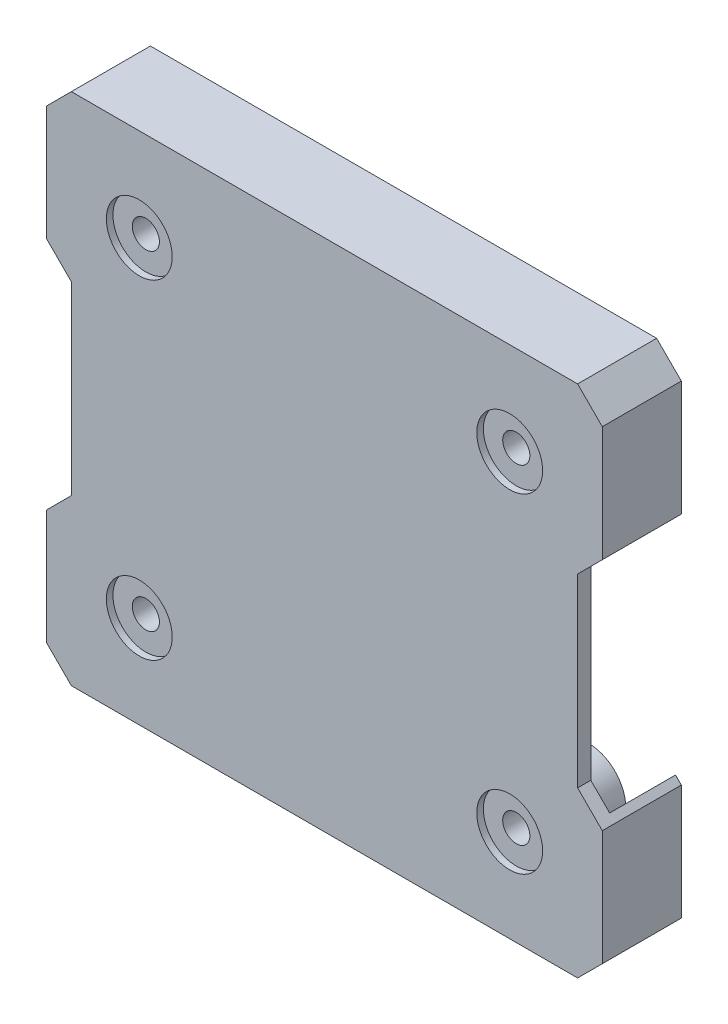
from build123d import *

# Parameters (mm, degrees)
SKETCH_1_W           = 67.5
SKETCH_1_H           = 62.5
EXTRUDE_1_DEPTH      = 1.6
SKETCH_2_R           = 1.65
CUT_EXTRUDE_1_DEPTH  = 10
CHAMFER_1_SIZE       = 3
SKETCH_3_R           = 1.65
EXTRUDE_2_DEPTH      = 4
SKETCH_4_R           = 4
CUT_EXTRUDE_2_DEPTH  = 0.8
SKETCH_5_R           = 4.5
EXTRUDE_3_DEPTH      = 6
EXTRUDE_4_DEPTH      = 8
EXTRUDE_5_DEPTH      = 2
CUT_EXTRUDE_4_DEPTH  = 8
EXTRUDE_6_DEPTH      = 2
EXTRUDE_6_DEPTH_BACK = 2
SKETCH_10_R          = 4.5
SKETCH_10_R_2        = 1.65


with BuildPart() as part:
    # 草图1 → 凸台-拉伸1 (new body)
    with BuildSketch(Plane.XY):
        Rectangle(SKETCH_1_W, SKETCH_1_H)
    extrude(amount=EXTRUDE_1_DEPTH)

    # 草图2 → 切除-拉伸1 (cut)
    with BuildSketch(Plane.XY.offset(1.6)):
        with Locations((-22.5, 20)):
            Circle(SKETCH_2_R)
        with Locations((22.5, 20)):
            Circle(SKETCH_2_R)
        with Locations((22.5, -20)):
            Circle(SKETCH_2_R)
        with Locations((-22.5, -20)):
            Circle(SKETCH_2_R)
        Polygon((-30.75, 11.25), (-30.75, -11.25), (-33.75, -14.25), (-33.75, 14.25), align=None)
        Polygon((30.75, 11.25), (30.75, -11.25), (33.75, -14.25), (33.75, 14.25), align=None)
    extrude(amount=-CUT_EXTRUDE_1_DEPTH, mode=Mode.SUBTRACT)

    # 倒角1
    chamfer_1_edges = [part.edges().sort_by_distance(p)[0] for p in [
        (33.75, -31.25, 0.8),
        (-33.75, -31.25, 0.8),
        (-33.75, 31.25, 0.8),
        (33.75, 31.25, 0.8),
    ]]
    chamfer(chamfer_1_edges, length=CHAMFER_1_SIZE)

    # 草图3 → 凸台-拉伸2 (add)
    # profile 1 of 4: a face of its own
    with BuildSketch(Plane(origin=(0, 0, 0), x_dir=(-1, 0, 0), z_dir=(0, 0, -1))):
        Polygon((-19.901923789, 20), (-21.200961894, 22.25), (-23.799038106, 22.25), (-25.098076211, 20), (-23.799038106, 17.75), (-21.200961894, 17.75), align=None)
        with Locations(Location((-22.5, 20, 0), (0, 0, 180))):
            Circle(SKETCH_3_R, mode=Mode.SUBTRACT)
    # profile 2 of 4: a face of its own
    with BuildSketch(Plane(origin=(0, 0, 0), x_dir=(-1, 0, 0), z_dir=(0, 0, -1))):
        Polygon((25.098076211, 20), (23.799038106, 22.25), (21.200961894, 22.25), (19.901923789, 20), (21.200961894, 17.75), (23.799038106, 17.75), align=None)
        with Locations(Location((22.5, 20, 0), (0, 0, 180))):
            Circle(SKETCH_3_R, mode=Mode.SUBTRACT)
    # profile 3 of 4: a face of its own
    with BuildSketch(Plane(origin=(0, 0, 0), x_dir=(-1, 0, 0), z_dir=(0, 0, -1))):
        Polygon((25.098076211, -20), (23.799038106, -17.75), (21.200961894, -17.75), (19.901923789, -20), (21.200961894, -22.25), (23.799038106, -22.25), align=None)
        with Locations(Location((22.5, -20, 0), (0, 0, 180))):
            Circle(SKETCH_3_R, mode=Mode.SUBTRACT)
    # profile 4 of 4: a face of its own
    with BuildSketch(Plane(origin=(0, 0, 0), x_dir=(-1, 0, 0), z_dir=(0, 0, -1))):
        Polygon((-19.901923789, -20), (-21.200961894, -17.75), (-23.799038106, -17.75), (-25.098076211, -20), (-23.799038106, -22.25), (-21.200961894, -22.25), align=None)
        with Locations(Location((-22.5, -20, 0), (0, 0, 180))):
            Circle(SKETCH_3_R, mode=Mode.SUBTRACT)
    extrude(amount=EXTRUDE_2_DEPTH)

    # 草图4 → 切除-拉伸2 (cut)
    with BuildSketch(Plane.XY.offset(1.6)):
        with Locations((-22.5, 20)):
            Circle(SKETCH_4_R)
        with Locations((22.5, 20)):
            Circle(SKETCH_4_R)
        with Locations((22.5, -20)):
            Circle(SKETCH_4_R)
        with Locations((-22.5, -20)):
            Circle(SKETCH_4_R)
    extrude(amount=-CUT_EXTRUDE_2_DEPTH, mode=Mode.SUBTRACT)

    # 草图5 → 凸台-拉伸3 (add)
    # profile 1 of 4: a face of its own
    with BuildSketch(Plane(origin=(0, 0, 0), x_dir=(-1, 0, 0), z_dir=(0, 0, -1))):
        with Locations(Location((-22.5, 20, 0), (0, 0, 180))):
            Circle(SKETCH_5_R)
        Polygon((-21.200961894, 17.75), (-19.901923789, 20), (-21.200961894, 22.25), (-23.799038106, 22.25), (-25.098076211, 20), (-23.799038106, 17.75), align=None, mode=Mode.SUBTRACT)
    # profile 2 of 4: a face of its own
    with BuildSketch(Plane(origin=(0, 0, 0), x_dir=(-1, 0, 0), z_dir=(0, 0, -1))):
        with Locations(Location((22.5, 20, 0), (0, 0, 180))):
            Circle(SKETCH_5_R)
        Polygon((23.799038106, 17.75), (25.098076211, 20), (23.799038106, 22.25), (21.200961894, 22.25), (19.901923789, 20), (21.200961894, 17.75), align=None, mode=Mode.SUBTRACT)
    # profile 3 of 4: a face of its own
    with BuildSketch(Plane(origin=(0, 0, 0), x_dir=(-1, 0, 0), z_dir=(0, 0, -1))):
        with Locations(Location((22.5, -20, 0), (0, 0, 180))):
            Circle(SKETCH_5_R)
        Polygon((23.799038106, -22.25), (25.098076211, -20), (23.799038106, -17.75), (21.200961894, -17.75), (19.901923789, -20), (21.200961894, -22.25), align=None, mode=Mode.SUBTRACT)
    # profile 4 of 4: a face of its own
    with BuildSketch(Plane(origin=(0, 0, 0), x_dir=(-1, 0, 0), z_dir=(0, 0, -1))):
        with Locations(Location((-22.5, -20, 0), (0, 0, 180))):
            Circle(SKETCH_5_R)
        Polygon((-21.200961894, -22.25), (-19.901923789, -20), (-21.200961894, -17.75), (-23.799038106, -17.75), (-25.098076211, -20), (-23.799038106, -22.25), align=None, mode=Mode.SUBTRACT)
    extrude(amount=EXTRUDE_3_DEPTH)

    # 草图6 → 凸台-拉伸4 (add)
    with BuildSketch(Plane(origin=(0, 0, 0), x_dir=(-1, 0, 0), z_dir=(0, 0, -1))):
        Polygon((-30.75, -31.25), (30.75, -31.25), (33.75, -28.25), (33.75, -14.25), (30.75, -11.25), (30.75, 11.25), (33.75, 14.25), (33.75, 28.25), (30.75, 31.25), (-30.75, 31.25), (-33.75, 28.25), (-33.75, 14.25), (-30.75, 11.25), (-30.75, -11.25), (-33.75, -14.25), (-33.75, -28.25), align=None)
        Polygon((-30.335786438, -30.25), (30.335786438, -30.25), (32.75, -27.835786438), (32.75, -14.664213562), (29.75, -11.664213562), (29.75, 11.664213562), (32.75, 14.664213562), (32.75, 27.835786438), (30.335786438, 30.25), (-30.335786438, 30.25), (-32.75, 27.835786438), (-32.75, 14.664213562), (-29.75, 11.664213562), (-29.75, -11.664213562), (-32.75, -14.664213562), (-32.75, -27.835786438), align=None, mode=Mode.SUBTRACT)
    extrude(amount=EXTRUDE_4_DEPTH)

    # 草图8 → 凸台-拉伸5 (add)
    with BuildSketch(Plane(origin=(0, 0, 0), x_dir=(-1, 0, 0), z_dir=(0, 0, -1))):
        with BuildLine():
            Line((-1.5, -11.14955156), (-1.5, -12.157816416))
            ThreePointArc((-1.5, -12.157816416), (0, 12.25), (1.5, -12.157816416))
            Line((1.5, -12.157816416), (1.5, -11.14955156))
            ThreePointArc((1.5, -11.14955156), (0, 11.25), (-1.5, -11.14955156))
        make_face()
    extrude(amount=EXTRUDE_5_DEPTH)

    # 草图9 → 切除-拉伸4 (cut)
    with BuildSketch(Plane(origin=(0, 0, -8), x_dir=(-1, 0, 0), z_dir=(0, 0, -1))):
        Polygon((29.75, 11.664213562), (32.335786438, 14.25), (33.042893219, 13.542893219), (30.75, 11.25), (30.75, -11.25), (33.042893219, -13.542893219), (32.335786438, -14.25), (29.75, -11.664213562), align=None)
        Polygon((-33.042893219, 13.542893219), (-32.335786438, 14.25), (-29.75, 11.664213562), (-29.75, -11.664213562), (-32.335786438, -14.25), (-33.042893219, -13.542893219), (-30.75, -11.25), (-30.75, 11.25), align=None)
    extrude(amount=-CUT_EXTRUDE_4_DEPTH, mode=Mode.SUBTRACT)

    # 草图10 → 凸台-拉伸6 (add, two sides: drawn at the far end of the back side and taken through both)
    # profile 1 of 4: a face of its own
    with BuildSketch(Plane(origin=(0, 0, -6), x_dir=(-1, 0, 0), z_dir=(0, 0, -1)).offset(-EXTRUDE_6_DEPTH_BACK)):
        with Locations(Location((-22.5, -20, 0), (0, 0, 180))):
            Circle(SKETCH_10_R)
        with Locations(Location((-22.5, -20, 0), (0, 0, 180))):
            Circle(SKETCH_10_R_2, mode=Mode.SUBTRACT)
    # profile 2 of 4: a face of its own
    with BuildSketch(Plane(origin=(0, 0, -6), x_dir=(-1, 0, 0), z_dir=(0, 0, -1)).offset(-EXTRUDE_6_DEPTH_BACK)):
        with Locations(Location((22.5, 20, 0), (0, 0, 180))):
            Circle(SKETCH_10_R)
        with Locations(Location((22.5, 20, 0), (0, 0, 180))):
            Circle(SKETCH_10_R_2, mode=Mode.SUBTRACT)
    # profile 3 of 4: a face of its own
    with BuildSketch(Plane(origin=(0, 0, -6), x_dir=(-1, 0, 0), z_dir=(0, 0, -1)).offset(-EXTRUDE_6_DEPTH_BACK)):
        with Locations(Location((-22.5, 20, 0), (0, 0, 180))):
            Circle(SKETCH_10_R)
        with Locations(Location((-22.5, 20, 0), (0, 0, 180))):
            Circle(SKETCH_10_R_2, mode=Mode.SUBTRACT)
    # profile 4 of 4: a face of its own
    with BuildSketch(Plane(origin=(0, 0, -6), x_dir=(-1, 0, 0), z_dir=(0, 0, -1)).offset(-EXTRUDE_6_DEPTH_BACK)):
        with Locations(Location((22.5, -20, 0), (0, 0, 180))):
            Circle(SKETCH_10_R)
        with Locations(Location((22.5, -20, 0), (0, 0, 180))):
            Circle(SKETCH_10_R_2, mode=Mode.SUBTRACT)
    extrude(amount=EXTRUDE_6_DEPTH + EXTRUDE_6_DEPTH_BACK)


solid = part.part
